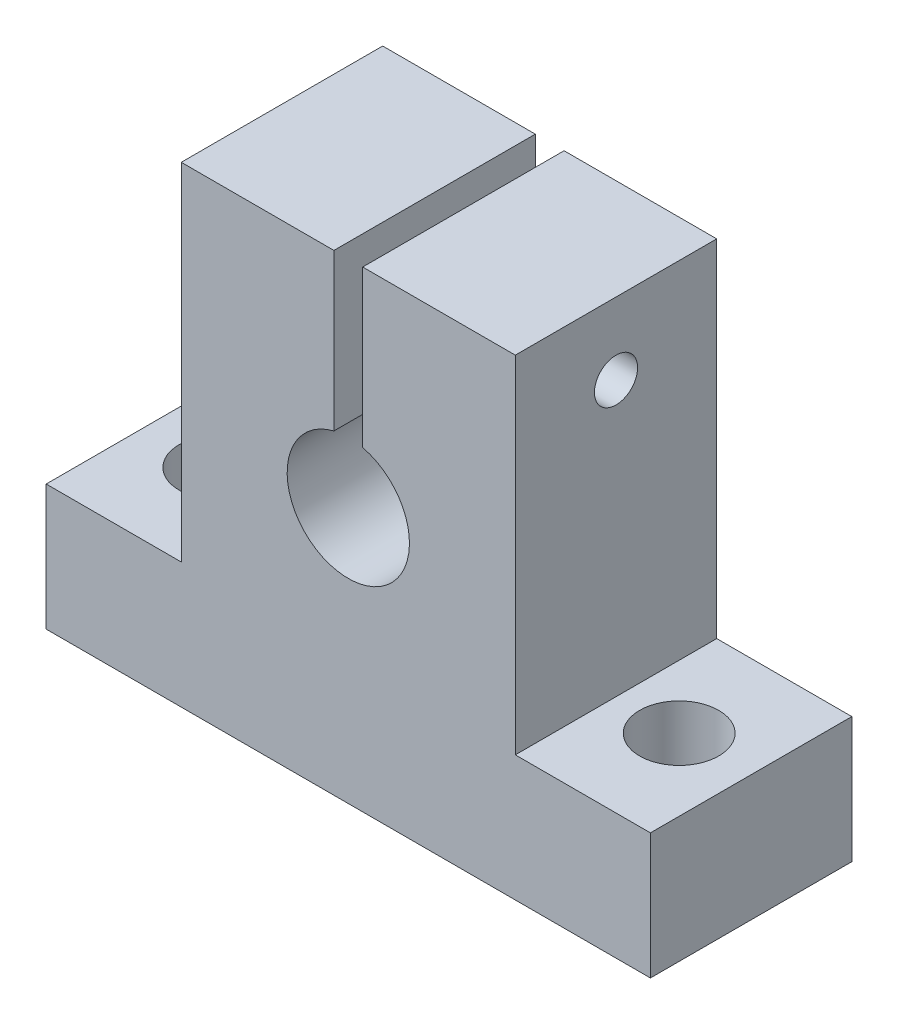
from build123d import *

# Parameters (mm, degrees)
BOSS_EXTRUDE1_DEPTH = 14
SKETCH2_R           = 4.25
CUT_EXTRUDE1_DEPTH  = 56.098457329
SKETCH3_R           = 2.75
CUT_EXTRUDE2_DEPTH  = 51.388516183
SKETCH4_R           = 1.5
CUT_EXTRUDE3_DEPTH  = 49.323962746


with BuildPart() as part:
    # Sketch1 → Boss-Extrude1 (new body)
    with BuildSketch(Plane.XY):
        Polygon((0, 0), (42, 0), (42, 8.73752791), (32.609283578, 8.73752791), (32.609283578, 32.8), (22, 32.8), (22, 17.8), (20, 17.8), (20, 32.8), (9.390716422, 32.8), (9.390716422, 8.73752791), (0, 8.73752791), align=None)
    extrude(amount=BOSS_EXTRUDE1_DEPTH)

    # Sketch2 → Cut-Extrude1 (cut, through all)
    with BuildSketch(Plane.XY.offset(14)):
        with Locations((21, 17.8)):
            Circle(SKETCH2_R)
    extrude(amount=-CUT_EXTRUDE1_DEPTH, mode=Mode.SUBTRACT)

    # Sketch3 → Cut-Extrude2 (cut, through all)
    with BuildSketch(Plane(origin=(0, 8.73752791, 0), x_dir=(1, 0, 0), z_dir=(0, 1, 0))):
        with Locations(Location((5, -7, 0), (0, 0, 180))):
            Circle(SKETCH3_R)
        with Locations(Location((37, -7, 0), (0, 0, 180))):
            Circle(SKETCH3_R)
    extrude(amount=-CUT_EXTRUDE2_DEPTH, mode=Mode.SUBTRACT)

    # Sketch4 → Cut-Extrude3 (cut, through all)
    with BuildSketch(Plane(origin=(32.609283578, 0, 0), x_dir=(0, 0, -1), z_dir=(1, 0, 0))):
        with Locations((-7, 27.8)):
            Circle(SKETCH4_R)
    extrude(amount=-CUT_EXTRUDE3_DEPTH, mode=Mode.SUBTRACT)


solid = part.part
